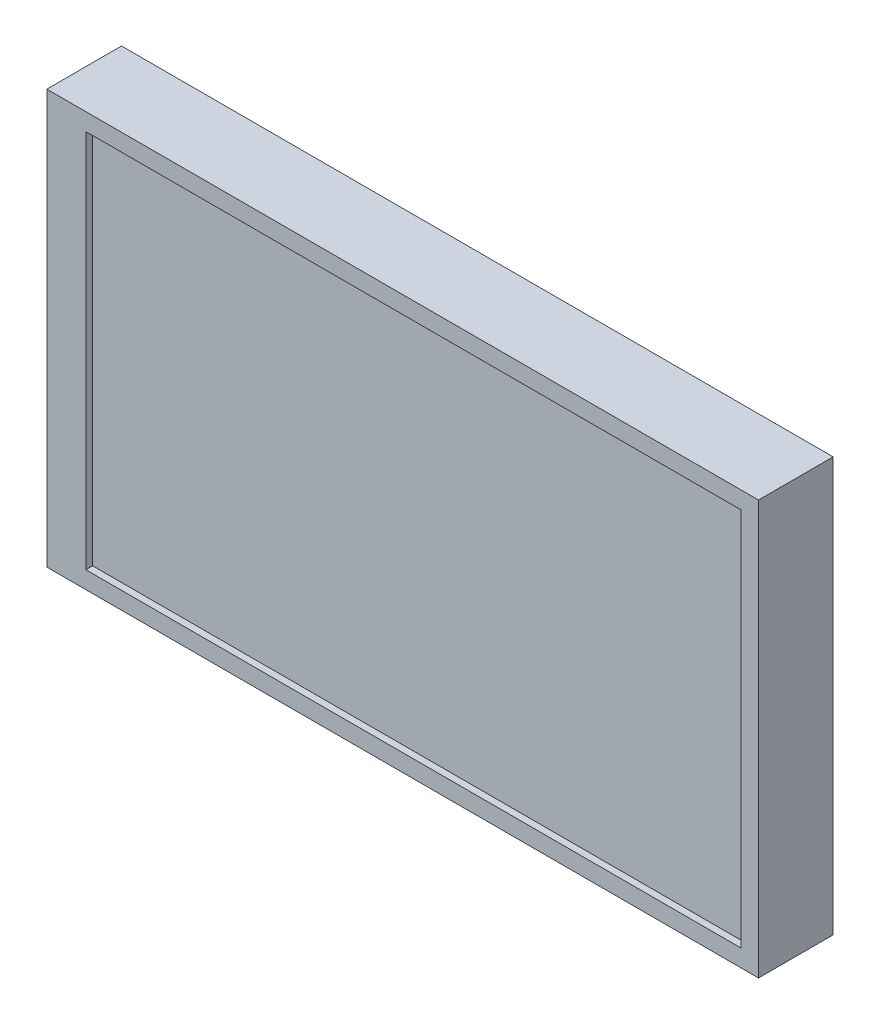
from build123d import *

# Parameters (mm, degrees)
SKETCH2_W                 = 508
SKETCH2_H                 = 304.8
BOSS_EXTRUDE1_DEPTH       = 55
M6X1_0_TAPPED_HOLE1_D     = 5
M6X1_0_TAPPED_HOLE1_DEPTH = 17
M6X1_0_TAPPED_HOLE1_TIP   = 1.502151548
SKETCH6_W                 = 482.6
SKETCH6_H                 = 279.4
CUT_EXTRUDE1_DEPTH        = 5
SKETCH7_W                 = 55
SKETCH7_H                 = 304.8
BOSS_EXTRUDE2_DEPTH       = 16


with BuildPart() as part:
    # Sketch2 → Boss-Extrude1 (new body)
    with BuildSketch(Plane.XY):
        Rectangle(SKETCH2_W, SKETCH2_H)
    extrude(amount=BOSS_EXTRUDE1_DEPTH)

    # M6x1.0 Tapped Hole1
    with Locations(Plane(origin=(0, 0, 0), x_dir=(-1, 0, 0), z_dir=(0, 0, -1))):
        with Locations((50, 50), (-50, -50), (-50, 50), (50, -50)):
            Hole(M6X1_0_TAPPED_HOLE1_D / 2, depth=M6X1_0_TAPPED_HOLE1_DEPTH)
            with Locations((0, 0, -(M6X1_0_TAPPED_HOLE1_DEPTH + M6X1_0_TAPPED_HOLE1_TIP / 2))):  # 118° drill point
                Cone(0, M6X1_0_TAPPED_HOLE1_D / 2, M6X1_0_TAPPED_HOLE1_TIP, mode=Mode.SUBTRACT)

    # Sketch6 → Cut-Extrude1 (cut)
    with BuildSketch(Plane.XY.offset(55)):
        Rectangle(SKETCH6_W, SKETCH6_H)
    extrude(amount=-CUT_EXTRUDE1_DEPTH, mode=Mode.SUBTRACT)

    # Sketch7 → Boss-Extrude2 (add)
    with BuildSketch(Plane.ZY.offset(254)):
        with Locations((27.5, 0)):
            Rectangle(SKETCH7_W, SKETCH7_H)
    extrude(amount=BOSS_EXTRUDE2_DEPTH)


solid = part.part
